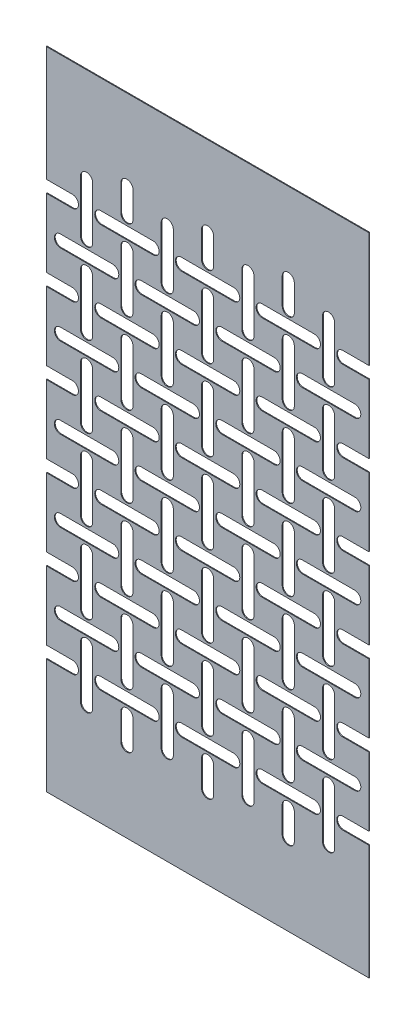
from build123d import *

# Parameters (mm, degrees)
BOSS_EXTRUDE1_DEPTH = 0.2


with BuildPart() as part:
    # Model → Boss-Extrude1 (new body)
    with BuildSketch(Plane.XY):
        with BuildLine():
            Line((0, 31.5), (6.4793, 31.5))
            ThreePointArc((6.4793, 31.5), (7.9793, 30), (6.4793, 28.5))
            Line((6.4793, 28.5), (0, 28.5))
            Line((0, 28.5), (0, 0))
            Line((0, 0), (80, 0))
            Line((80, 0), (80, 28.5))
            Line((80, 28.5), (73.5207, 28.5))
            ThreePointArc((73.5207, 28.5), (72.0207, 30), (73.5207, 31.5))
            Line((73.5207, 31.5), (80, 31.5))
            Line((80, 31.5), (80, 48.5))
            Line((80, 48.5), (73.5207, 48.5))
            ThreePointArc((73.5207, 48.5), (72.0207, 50), (73.5207, 51.5))
            Line((73.5207, 51.5), (80, 51.5))
            Line((80, 51.5), (80, 68.5))
            Line((80, 68.5), (73.5207, 68.5))
            ThreePointArc((73.5207, 68.5), (72.0207, 70), (73.5207, 71.5))
            Line((73.5207, 71.5), (80, 71.5))
            Line((80, 71.5), (80, 88.5))
            Line((80, 88.5), (73.5207, 88.5))
            ThreePointArc((73.5207, 88.5), (72.0207, 90), (73.5207, 91.5))
            Line((73.5207, 91.5), (80, 91.5))
            Line((80, 91.5), (80, 108.5))
            Line((80, 108.5), (73.5207, 108.5))
            ThreePointArc((73.5207, 108.5), (72.0207, 110), (73.5207, 111.5))
            Line((73.5207, 111.5), (80, 111.5))
            Line((80, 111.5), (80, 128.5))
            Line((80, 128.5), (73.5207, 128.5))
            ThreePointArc((73.5207, 128.5), (72.0207, 130), (73.5207, 131.5))
            Line((73.5207, 131.5), (80, 131.5))
            Line((80, 131.5), (80, 160))
            Line((80, 160), (0, 160))
            Line((0, 160), (0, 131.5))
            Line((0, 131.5), (6.4793, 131.5))
            ThreePointArc((6.4793, 131.5), (7.9793, 130), (6.4793, 128.5))
            Line((6.4793, 128.5), (0, 128.5))
            Line((0, 128.5), (0, 111.5))
            Line((0, 111.5), (6.4793, 111.5))
            ThreePointArc((6.4793, 111.5), (7.9793, 110), (6.4793, 108.5))
            Line((6.4793, 108.5), (0, 108.5))
            Line((0, 108.5), (0, 91.5))
            Line((0, 91.5), (6.4793, 91.5))
            ThreePointArc((6.4793, 91.5), (7.9793, 90), (6.4793, 88.5))
            Line((6.4793, 88.5), (0, 88.5))
            Line((0, 88.5), (0, 71.5))
            Line((0, 71.5), (6.4793, 71.5))
            ThreePointArc((6.4793, 71.5), (7.9793, 70), (6.4793, 68.5))
            Line((6.4793, 68.5), (0, 68.5))
            Line((0, 68.5), (0, 51.5))
            Line((0, 51.5), (6.4793, 51.5))
            ThreePointArc((6.4793, 51.5), (7.9793, 50), (6.4793, 48.5))
            Line((6.4793, 48.5), (0, 48.5))
            Line((0, 48.5), (0, 31.5))
        make_face()
        with BuildLine():
            Line((13.5207, 31.5), (26.4793, 31.5))
            ThreePointArc((26.4793, 31.5), (27.9793, 30), (26.4793, 28.5))
            Line((26.4793, 28.5), (13.5207, 28.5))
            ThreePointArc((13.5207, 28.5), (12.0207, 30), (13.5207, 31.5))
        make_face(mode=Mode.SUBTRACT)
        with BuildLine():
            Line((33.5207, 31.5), (46.4793, 31.5))
            ThreePointArc((46.4793, 31.5), (47.9793, 30), (46.4793, 28.5))
            Line((46.4793, 28.5), (33.5207, 28.5))
            ThreePointArc((33.5207, 28.5), (32.0207, 30), (33.5207, 31.5))
        make_face(mode=Mode.SUBTRACT)
        with BuildLine():
            Line((53.5207, 31.5), (66.4793, 31.5))
            ThreePointArc((66.4793, 31.5), (67.9793, 30), (66.4793, 28.5))
            Line((66.4793, 28.5), (53.5207, 28.5))
            ThreePointArc((53.5207, 28.5), (52.0207, 30), (53.5207, 31.5))
        make_face(mode=Mode.SUBTRACT)
        with BuildLine():
            Line((3.5207, 41.5), (16.4793, 41.5))
            ThreePointArc((16.4793, 41.5), (17.9793, 40), (16.4793, 38.5))
            Line((16.4793, 38.5), (3.5207, 38.5))
            ThreePointArc((3.5207, 38.5), (2.0207, 40), (3.5207, 41.5))
        make_face(mode=Mode.SUBTRACT)
        with BuildLine():
            Line((23.5207, 41.5), (36.4793, 41.5))
            ThreePointArc((36.4793, 41.5), (37.9793, 40), (36.4793, 38.5))
            Line((36.4793, 38.5), (23.5207, 38.5))
            ThreePointArc((23.5207, 38.5), (22.0207, 40), (23.5207, 41.5))
        make_face(mode=Mode.SUBTRACT)
        with BuildLine():
            Line((43.5207, 41.5), (56.4793, 41.5))
            ThreePointArc((56.4793, 41.5), (57.9793, 40), (56.4793, 38.5))
            Line((56.4793, 38.5), (43.5207, 38.5))
            ThreePointArc((43.5207, 38.5), (42.0207, 40), (43.5207, 41.5))
        make_face(mode=Mode.SUBTRACT)
        with BuildLine():
            Line((63.5207, 41.5), (76.4793, 41.5))
            ThreePointArc((76.4793, 41.5), (77.9793, 40), (76.4793, 38.5))
            Line((76.4793, 38.5), (63.5207, 38.5))
            ThreePointArc((63.5207, 38.5), (62.0207, 40), (63.5207, 41.5))
        make_face(mode=Mode.SUBTRACT)
        with BuildLine():
            Line((13.5207, 51.5), (26.4793, 51.5))
            ThreePointArc((26.4793, 51.5), (27.9793, 50), (26.4793, 48.5))
            Line((26.4793, 48.5), (13.5207, 48.5))
            ThreePointArc((13.5207, 48.5), (12.0207, 50), (13.5207, 51.5))
        make_face(mode=Mode.SUBTRACT)
        with BuildLine():
            Line((33.5207, 51.5), (46.4793, 51.5))
            ThreePointArc((46.4793, 51.5), (47.9793, 50), (46.4793, 48.5))
            Line((46.4793, 48.5), (33.5207, 48.5))
            ThreePointArc((33.5207, 48.5), (32.0207, 50), (33.5207, 51.5))
        make_face(mode=Mode.SUBTRACT)
        with BuildLine():
            Line((53.5207, 51.5), (66.4793, 51.5))
            ThreePointArc((66.4793, 51.5), (67.9793, 50), (66.4793, 48.5))
            Line((66.4793, 48.5), (53.5207, 48.5))
            ThreePointArc((53.5207, 48.5), (52.0207, 50), (53.5207, 51.5))
        make_face(mode=Mode.SUBTRACT)
        with BuildLine():
            Line((3.5207, 61.5), (16.4793, 61.5))
            ThreePointArc((16.4793, 61.5), (17.9793, 60), (16.4793, 58.5))
            Line((16.4793, 58.5), (3.5207, 58.5))
            ThreePointArc((3.5207, 58.5), (2.0207, 60), (3.5207, 61.5))
        make_face(mode=Mode.SUBTRACT)
        with BuildLine():
            Line((23.5207, 61.5), (36.4793, 61.5))
            ThreePointArc((36.4793, 61.5), (37.9793, 60), (36.4793, 58.5))
            Line((36.4793, 58.5), (23.5207, 58.5))
            ThreePointArc((23.5207, 58.5), (22.0207, 60), (23.5207, 61.5))
        make_face(mode=Mode.SUBTRACT)
        with BuildLine():
            Line((43.5207, 61.5), (56.4793, 61.5))
            ThreePointArc((56.4793, 61.5), (57.9793, 60), (56.4793, 58.5))
            Line((56.4793, 58.5), (43.5207, 58.5))
            ThreePointArc((43.5207, 58.5), (42.0207, 60), (43.5207, 61.5))
        make_face(mode=Mode.SUBTRACT)
        with BuildLine():
            Line((63.5207, 61.5), (76.4793, 61.5))
            ThreePointArc((76.4793, 61.5), (77.9793, 60), (76.4793, 58.5))
            Line((76.4793, 58.5), (63.5207, 58.5))
            ThreePointArc((63.5207, 58.5), (62.0207, 60), (63.5207, 61.5))
        make_face(mode=Mode.SUBTRACT)
        with BuildLine():
            Line((13.5207, 71.5), (26.4793, 71.5))
            ThreePointArc((26.4793, 71.5), (27.9793, 70), (26.4793, 68.5))
            Line((26.4793, 68.5), (13.5207, 68.5))
            ThreePointArc((13.5207, 68.5), (12.0207, 70), (13.5207, 71.5))
        make_face(mode=Mode.SUBTRACT)
        with BuildLine():
            Line((33.5207, 71.5), (46.4793, 71.5))
            ThreePointArc((46.4793, 71.5), (47.9793, 70), (46.4793, 68.5))
            Line((46.4793, 68.5), (33.5207, 68.5))
            ThreePointArc((33.5207, 68.5), (32.0207, 70), (33.5207, 71.5))
        make_face(mode=Mode.SUBTRACT)
        with BuildLine():
            Line((53.5207, 71.5), (66.4793, 71.5))
            ThreePointArc((66.4793, 71.5), (67.9793, 70), (66.4793, 68.5))
            Line((66.4793, 68.5), (53.5207, 68.5))
            ThreePointArc((53.5207, 68.5), (52.0207, 70), (53.5207, 71.5))
        make_face(mode=Mode.SUBTRACT)
        with BuildLine():
            Line((3.5207, 81.5), (16.4793, 81.5))
            ThreePointArc((16.4793, 81.5), (17.9793, 80), (16.4793, 78.5))
            Line((16.4793, 78.5), (3.5207, 78.5))
            ThreePointArc((3.5207, 78.5), (2.0207, 80), (3.5207, 81.5))
        make_face(mode=Mode.SUBTRACT)
        with BuildLine():
            Line((23.5207, 81.5), (36.4793, 81.5))
            ThreePointArc((36.4793, 81.5), (37.9793, 80), (36.4793, 78.5))
            Line((36.4793, 78.5), (23.5207, 78.5))
            ThreePointArc((23.5207, 78.5), (22.0207, 80), (23.5207, 81.5))
        make_face(mode=Mode.SUBTRACT)
        with BuildLine():
            Line((43.5207, 81.5), (56.4793, 81.5))
            ThreePointArc((56.4793, 81.5), (57.9793, 80), (56.4793, 78.5))
            Line((56.4793, 78.5), (43.5207, 78.5))
            ThreePointArc((43.5207, 78.5), (42.0207, 80), (43.5207, 81.5))
        make_face(mode=Mode.SUBTRACT)
        with BuildLine():
            Line((63.5207, 81.5), (76.4793, 81.5))
            ThreePointArc((76.4793, 81.5), (77.9793, 80), (76.4793, 78.5))
            Line((76.4793, 78.5), (63.5207, 78.5))
            ThreePointArc((63.5207, 78.5), (62.0207, 80), (63.5207, 81.5))
        make_face(mode=Mode.SUBTRACT)
        with BuildLine():
            Line((13.5207, 91.5), (26.4793, 91.5))
            ThreePointArc((26.4793, 91.5), (27.9793, 90), (26.4793, 88.5))
            Line((26.4793, 88.5), (13.5207, 88.5))
            ThreePointArc((13.5207, 88.5), (12.0207, 90), (13.5207, 91.5))
        make_face(mode=Mode.SUBTRACT)
        with BuildLine():
            Line((33.5207, 91.5), (46.4793, 91.5))
            ThreePointArc((46.4793, 91.5), (47.9793, 90), (46.4793, 88.5))
            Line((46.4793, 88.5), (33.5207, 88.5))
            ThreePointArc((33.5207, 88.5), (32.0207, 90), (33.5207, 91.5))
        make_face(mode=Mode.SUBTRACT)
        with BuildLine():
            Line((53.5207, 91.5), (66.4793, 91.5))
            ThreePointArc((66.4793, 91.5), (67.9793, 90), (66.4793, 88.5))
            Line((66.4793, 88.5), (53.5207, 88.5))
            ThreePointArc((53.5207, 88.5), (52.0207, 90), (53.5207, 91.5))
        make_face(mode=Mode.SUBTRACT)
        with BuildLine():
            Line((3.5207, 101.5), (16.4793, 101.5))
            ThreePointArc((16.4793, 101.5), (17.9793, 100), (16.4793, 98.5))
            Line((16.4793, 98.5), (3.5207, 98.5))
            ThreePointArc((3.5207, 98.5), (2.0207, 100), (3.5207, 101.5))
        make_face(mode=Mode.SUBTRACT)
        with BuildLine():
            Line((23.5207, 101.5), (36.4793, 101.5))
            ThreePointArc((36.4793, 101.5), (37.9793, 100), (36.4793, 98.5))
            Line((36.4793, 98.5), (23.5207, 98.5))
            ThreePointArc((23.5207, 98.5), (22.0207, 100), (23.5207, 101.5))
        make_face(mode=Mode.SUBTRACT)
        with BuildLine():
            Line((43.5207, 101.5), (56.4793, 101.5))
            ThreePointArc((56.4793, 101.5), (57.9793, 100), (56.4793, 98.5))
            Line((56.4793, 98.5), (43.5207, 98.5))
            ThreePointArc((43.5207, 98.5), (42.0207, 100), (43.5207, 101.5))
        make_face(mode=Mode.SUBTRACT)
        with BuildLine():
            Line((63.5207, 101.5), (76.4793, 101.5))
            ThreePointArc((76.4793, 101.5), (77.9793, 100), (76.4793, 98.5))
            Line((76.4793, 98.5), (63.5207, 98.5))
            ThreePointArc((63.5207, 98.5), (62.0207, 100), (63.5207, 101.5))
        make_face(mode=Mode.SUBTRACT)
        with BuildLine():
            Line((13.5207, 111.5), (26.4793, 111.5))
            ThreePointArc((26.4793, 111.5), (27.9793, 110), (26.4793, 108.5))
            Line((26.4793, 108.5), (13.5207, 108.5))
            ThreePointArc((13.5207, 108.5), (12.0207, 110), (13.5207, 111.5))
        make_face(mode=Mode.SUBTRACT)
        with BuildLine():
            Line((33.5207, 111.5), (46.4793, 111.5))
            ThreePointArc((46.4793, 111.5), (47.9793, 110), (46.4793, 108.5))
            Line((46.4793, 108.5), (33.5207, 108.5))
            ThreePointArc((33.5207, 108.5), (32.0207, 110), (33.5207, 111.5))
        make_face(mode=Mode.SUBTRACT)
        with BuildLine():
            Line((53.5207, 111.5), (66.4793, 111.5))
            ThreePointArc((66.4793, 111.5), (67.9793, 110), (66.4793, 108.5))
            Line((66.4793, 108.5), (53.5207, 108.5))
            ThreePointArc((53.5207, 108.5), (52.0207, 110), (53.5207, 111.5))
        make_face(mode=Mode.SUBTRACT)
        with BuildLine():
            Line((3.5207, 121.5), (16.4793, 121.5))
            ThreePointArc((16.4793, 121.5), (17.9793, 120), (16.4793, 118.5))
            Line((16.4793, 118.5), (3.5207, 118.5))
            ThreePointArc((3.5207, 118.5), (2.0207, 120), (3.5207, 121.5))
        make_face(mode=Mode.SUBTRACT)
        with BuildLine():
            Line((23.5207, 121.5), (36.4793, 121.5))
            ThreePointArc((36.4793, 121.5), (37.9793, 120), (36.4793, 118.5))
            Line((36.4793, 118.5), (23.5207, 118.5))
            ThreePointArc((23.5207, 118.5), (22.0207, 120), (23.5207, 121.5))
        make_face(mode=Mode.SUBTRACT)
        with BuildLine():
            Line((43.5207, 121.5), (56.4793, 121.5))
            ThreePointArc((56.4793, 121.5), (57.9793, 120), (56.4793, 118.5))
            Line((56.4793, 118.5), (43.5207, 118.5))
            ThreePointArc((43.5207, 118.5), (42.0207, 120), (43.5207, 121.5))
        make_face(mode=Mode.SUBTRACT)
        with BuildLine():
            Line((63.5207, 121.5), (76.4793, 121.5))
            ThreePointArc((76.4793, 121.5), (77.9793, 120), (76.4793, 118.5))
            Line((76.4793, 118.5), (63.5207, 118.5))
            ThreePointArc((63.5207, 118.5), (62.0207, 120), (63.5207, 121.5))
        make_face(mode=Mode.SUBTRACT)
        with BuildLine():
            Line((13.5207, 131.5), (26.4793, 131.5))
            ThreePointArc((26.4793, 131.5), (27.9793, 130), (26.4793, 128.5))
            Line((26.4793, 128.5), (13.5207, 128.5))
            ThreePointArc((13.5207, 128.5), (12.0207, 130), (13.5207, 131.5))
        make_face(mode=Mode.SUBTRACT)
        with BuildLine():
            Line((33.5207, 131.5), (46.4793, 131.5))
            ThreePointArc((46.4793, 131.5), (47.9793, 130), (46.4793, 128.5))
            Line((46.4793, 128.5), (33.5207, 128.5))
            ThreePointArc((33.5207, 128.5), (32.0207, 130), (33.5207, 131.5))
        make_face(mode=Mode.SUBTRACT)
        with BuildLine():
            Line((53.5207, 131.5), (66.4793, 131.5))
            ThreePointArc((66.4793, 131.5), (67.9793, 130), (66.4793, 128.5))
            Line((66.4793, 128.5), (53.5207, 128.5))
            ThreePointArc((53.5207, 128.5), (52.0207, 130), (53.5207, 131.5))
        make_face(mode=Mode.SUBTRACT)
        with BuildLine():
            Line((11.5, 23.5207), (11.5, 36.4793))
            ThreePointArc((11.5, 36.4793), (10, 37.9793), (8.5, 36.4793))
            Line((8.5, 36.4793), (8.5, 23.5207))
            ThreePointArc((8.5, 23.5207), (10, 22.0207), (11.5, 23.5207))
        make_face(mode=Mode.SUBTRACT)
        with BuildLine():
            Line((11.5, 43.5207), (11.5, 56.4793))
            ThreePointArc((11.5, 56.4793), (10, 57.9793), (8.5, 56.4793))
            Line((8.5, 56.4793), (8.5, 43.5207))
            ThreePointArc((8.5, 43.5207), (10, 42.0207), (11.5, 43.5207))
        make_face(mode=Mode.SUBTRACT)
        with BuildLine():
            Line((11.5, 63.5207), (11.5, 76.4793))
            ThreePointArc((11.5, 76.4793), (10, 77.9793), (8.5, 76.4793))
            Line((8.5, 76.4793), (8.5, 63.5207))
            ThreePointArc((8.5, 63.5207), (10, 62.0207), (11.5, 63.5207))
        make_face(mode=Mode.SUBTRACT)
        with BuildLine():
            Line((11.5, 83.5207), (11.5, 96.4793))
            ThreePointArc((11.5, 96.4793), (10, 97.9793), (8.5, 96.4793))
            Line((8.5, 96.4793), (8.5, 83.5207))
            ThreePointArc((8.5, 83.5207), (10, 82.0207), (11.5, 83.5207))
        make_face(mode=Mode.SUBTRACT)
        with BuildLine():
            Line((11.5, 103.5207), (11.5, 116.4793))
            ThreePointArc((11.5, 116.4793), (10, 117.9793), (8.5, 116.4793))
            Line((8.5, 116.4793), (8.5, 103.5207))
            ThreePointArc((8.5, 103.5207), (10, 102.0207), (11.5, 103.5207))
        make_face(mode=Mode.SUBTRACT)
        with BuildLine():
            Line((11.5, 123.5207), (11.5, 136.4793))
            ThreePointArc((11.5, 136.4793), (10, 137.9793), (8.5, 136.4793))
            Line((8.5, 136.4793), (8.5, 123.5207))
            ThreePointArc((8.5, 123.5207), (10, 122.0207), (11.5, 123.5207))
        make_face(mode=Mode.SUBTRACT)
        with BuildLine():
            Line((21.5, 20), (21.5, 26.4793))
            ThreePointArc((21.5, 26.4793), (20, 27.9793), (18.5, 26.4793))
            Line((18.5, 26.4793), (18.5, 20))
            ThreePointArc((18.5, 20), (20, 18.5), (21.5, 20))
        make_face(mode=Mode.SUBTRACT)
        with BuildLine():
            Line((21.5, 33.5207), (21.5, 46.4793))
            ThreePointArc((21.5, 46.4793), (20, 47.9793), (18.5, 46.4793))
            Line((18.5, 46.4793), (18.5, 33.5207))
            ThreePointArc((18.5, 33.5207), (20, 32.0207), (21.5, 33.5207))
        make_face(mode=Mode.SUBTRACT)
        with BuildLine():
            Line((21.5, 53.5207), (21.5, 66.4793))
            ThreePointArc((21.5, 66.4793), (20, 67.9793), (18.5, 66.4793))
            Line((18.5, 66.4793), (18.5, 53.5207))
            ThreePointArc((18.5, 53.5207), (20, 52.0207), (21.5, 53.5207))
        make_face(mode=Mode.SUBTRACT)
        with BuildLine():
            Line((21.5, 73.5207), (21.5, 86.4793))
            ThreePointArc((21.5, 86.4793), (20, 87.9793), (18.5, 86.4793))
            Line((18.5, 86.4793), (18.5, 73.5207))
            ThreePointArc((18.5, 73.5207), (20, 72.0207), (21.5, 73.5207))
        make_face(mode=Mode.SUBTRACT)
        with BuildLine():
            Line((21.5, 93.5207), (21.5, 106.4793))
            ThreePointArc((21.5, 106.4793), (20, 107.9793), (18.5, 106.4793))
            Line((18.5, 106.4793), (18.5, 93.5207))
            ThreePointArc((18.5, 93.5207), (20, 92.0207), (21.5, 93.5207))
        make_face(mode=Mode.SUBTRACT)
        with BuildLine():
            Line((21.5, 113.5207), (21.5, 126.4793))
            ThreePointArc((21.5, 126.4793), (20, 127.9793), (18.5, 126.4793))
            Line((18.5, 126.4793), (18.5, 113.5207))
            ThreePointArc((18.5, 113.5207), (20, 112.0207), (21.5, 113.5207))
        make_face(mode=Mode.SUBTRACT)
        with BuildLine():
            Line((21.5, 133.5207), (21.5, 140))
            ThreePointArc((21.5, 140), (20, 141.5), (18.5, 140))
            Line((18.5, 140), (18.5, 133.5207))
            ThreePointArc((18.5, 133.5207), (20, 132.0207), (21.5, 133.5207))
        make_face(mode=Mode.SUBTRACT)
        with BuildLine():
            Line((31.5, 23.5207), (31.5, 36.4793))
            ThreePointArc((31.5, 36.4793), (30, 37.9793), (28.5, 36.4793))
            Line((28.5, 36.4793), (28.5, 23.5207))
            ThreePointArc((28.5, 23.5207), (30, 22.0207), (31.5, 23.5207))
        make_face(mode=Mode.SUBTRACT)
        with BuildLine():
            Line((31.5, 43.5207), (31.5, 56.4793))
            ThreePointArc((31.5, 56.4793), (30, 57.9793), (28.5, 56.4793))
            Line((28.5, 56.4793), (28.5, 43.5207))
            ThreePointArc((28.5, 43.5207), (30, 42.0207), (31.5, 43.5207))
        make_face(mode=Mode.SUBTRACT)
        with BuildLine():
            Line((31.5, 63.5207), (31.5, 76.4793))
            ThreePointArc((31.5, 76.4793), (30, 77.9793), (28.5, 76.4793))
            Line((28.5, 76.4793), (28.5, 63.5207))
            ThreePointArc((28.5, 63.5207), (30, 62.0207), (31.5, 63.5207))
        make_face(mode=Mode.SUBTRACT)
        with BuildLine():
            Line((31.5, 83.5207), (31.5, 96.4793))
            ThreePointArc((31.5, 96.4793), (30, 97.9793), (28.5, 96.4793))
            Line((28.5, 96.4793), (28.5, 83.5207))
            ThreePointArc((28.5, 83.5207), (30, 82.0207), (31.5, 83.5207))
        make_face(mode=Mode.SUBTRACT)
        with BuildLine():
            Line((31.5, 103.5207), (31.5, 116.4793))
            ThreePointArc((31.5, 116.4793), (30, 117.9793), (28.5, 116.4793))
            Line((28.5, 116.4793), (28.5, 103.5207))
            ThreePointArc((28.5, 103.5207), (30, 102.0207), (31.5, 103.5207))
        make_face(mode=Mode.SUBTRACT)
        with BuildLine():
            Line((31.5, 123.5207), (31.5, 136.4793))
            ThreePointArc((31.5, 136.4793), (30, 137.9793), (28.5, 136.4793))
            Line((28.5, 136.4793), (28.5, 123.5207))
            ThreePointArc((28.5, 123.5207), (30, 122.0207), (31.5, 123.5207))
        make_face(mode=Mode.SUBTRACT)
        with BuildLine():
            Line((41.5, 20), (41.5, 26.4793))
            ThreePointArc((41.5, 26.4793), (40, 27.9793), (38.5, 26.4793))
            Line((38.5, 26.4793), (38.5, 20))
            ThreePointArc((38.5, 20), (40, 18.5), (41.5, 20))
        make_face(mode=Mode.SUBTRACT)
        with BuildLine():
            Line((41.5, 33.5207), (41.5, 46.4793))
            ThreePointArc((41.5, 46.4793), (40, 47.9793), (38.5, 46.4793))
            Line((38.5, 46.4793), (38.5, 33.5207))
            ThreePointArc((38.5, 33.5207), (40, 32.0207), (41.5, 33.5207))
        make_face(mode=Mode.SUBTRACT)
        with BuildLine():
            Line((41.5, 53.5207), (41.5, 66.4793))
            ThreePointArc((41.5, 66.4793), (40, 67.9793), (38.5, 66.4793))
            Line((38.5, 66.4793), (38.5, 53.5207))
            ThreePointArc((38.5, 53.5207), (40, 52.0207), (41.5, 53.5207))
        make_face(mode=Mode.SUBTRACT)
        with BuildLine():
            Line((41.5, 73.5207), (41.5, 86.4793))
            ThreePointArc((41.5, 86.4793), (40, 87.9793), (38.5, 86.4793))
            Line((38.5, 86.4793), (38.5, 73.5207))
            ThreePointArc((38.5, 73.5207), (40, 72.0207), (41.5, 73.5207))
        make_face(mode=Mode.SUBTRACT)
        with BuildLine():
            Line((41.5, 93.5207), (41.5, 106.4793))
            ThreePointArc((41.5, 106.4793), (40, 107.9793), (38.5, 106.4793))
            Line((38.5, 106.4793), (38.5, 93.5207))
            ThreePointArc((38.5, 93.5207), (40, 92.0207), (41.5, 93.5207))
        make_face(mode=Mode.SUBTRACT)
        with BuildLine():
            Line((41.5, 113.5207), (41.5, 126.4793))
            ThreePointArc((41.5, 126.4793), (40, 127.9793), (38.5, 126.4793))
            Line((38.5, 126.4793), (38.5, 113.5207))
            ThreePointArc((38.5, 113.5207), (40, 112.0207), (41.5, 113.5207))
        make_face(mode=Mode.SUBTRACT)
        with BuildLine():
            Line((41.5, 133.5207), (41.5, 140))
            ThreePointArc((41.5, 140), (40, 141.5), (38.5, 140))
            Line((38.5, 140), (38.5, 133.5207))
            ThreePointArc((38.5, 133.5207), (40, 132.0207), (41.5, 133.5207))
        make_face(mode=Mode.SUBTRACT)
        with BuildLine():
            Line((51.5, 23.5207), (51.5, 36.4793))
            ThreePointArc((51.5, 36.4793), (50, 37.9793), (48.5, 36.4793))
            Line((48.5, 36.4793), (48.5, 23.5207))
            ThreePointArc((48.5, 23.5207), (50, 22.0207), (51.5, 23.5207))
        make_face(mode=Mode.SUBTRACT)
        with BuildLine():
            Line((51.5, 43.5207), (51.5, 56.4793))
            ThreePointArc((51.5, 56.4793), (50, 57.9793), (48.5, 56.4793))
            Line((48.5, 56.4793), (48.5, 43.5207))
            ThreePointArc((48.5, 43.5207), (50, 42.0207), (51.5, 43.5207))
        make_face(mode=Mode.SUBTRACT)
        with BuildLine():
            Line((51.5, 63.5207), (51.5, 76.4793))
            ThreePointArc((51.5, 76.4793), (50, 77.9793), (48.5, 76.4793))
            Line((48.5, 76.4793), (48.5, 63.5207))
            ThreePointArc((48.5, 63.5207), (50, 62.0207), (51.5, 63.5207))
        make_face(mode=Mode.SUBTRACT)
        with BuildLine():
            Line((51.5, 83.5207), (51.5, 96.4793))
            ThreePointArc((51.5, 96.4793), (50, 97.9793), (48.5, 96.4793))
            Line((48.5, 96.4793), (48.5, 83.5207))
            ThreePointArc((48.5, 83.5207), (50, 82.0207), (51.5, 83.5207))
        make_face(mode=Mode.SUBTRACT)
        with BuildLine():
            Line((51.5, 103.5207), (51.5, 116.4793))
            ThreePointArc((51.5, 116.4793), (50, 117.9793), (48.5, 116.4793))
            Line((48.5, 116.4793), (48.5, 103.5207))
            ThreePointArc((48.5, 103.5207), (50, 102.0207), (51.5, 103.5207))
        make_face(mode=Mode.SUBTRACT)
        with BuildLine():
            Line((51.5, 123.5207), (51.5, 136.4793))
            ThreePointArc((51.5, 136.4793), (50, 137.9793), (48.5, 136.4793))
            Line((48.5, 136.4793), (48.5, 123.5207))
            ThreePointArc((48.5, 123.5207), (50, 122.0207), (51.5, 123.5207))
        make_face(mode=Mode.SUBTRACT)
        with BuildLine():
            Line((61.5, 20), (61.5, 26.4793))
            ThreePointArc((61.5, 26.4793), (60, 27.9793), (58.5, 26.4793))
            Line((58.5, 26.4793), (58.5, 20))
            ThreePointArc((58.5, 20), (60, 18.5), (61.5, 20))
        make_face(mode=Mode.SUBTRACT)
        with BuildLine():
            Line((61.5, 33.5207), (61.5, 46.4793))
            ThreePointArc((61.5, 46.4793), (60, 47.9793), (58.5, 46.4793))
            Line((58.5, 46.4793), (58.5, 33.5207))
            ThreePointArc((58.5, 33.5207), (60, 32.0207), (61.5, 33.5207))
        make_face(mode=Mode.SUBTRACT)
        with BuildLine():
            Line((61.5, 53.5207), (61.5, 66.4793))
            ThreePointArc((61.5, 66.4793), (60, 67.9793), (58.5, 66.4793))
            Line((58.5, 66.4793), (58.5, 53.5207))
            ThreePointArc((58.5, 53.5207), (60, 52.0207), (61.5, 53.5207))
        make_face(mode=Mode.SUBTRACT)
        with BuildLine():
            Line((61.5, 73.5207), (61.5, 86.4793))
            ThreePointArc((61.5, 86.4793), (60, 87.9793), (58.5, 86.4793))
            Line((58.5, 86.4793), (58.5, 73.5207))
            ThreePointArc((58.5, 73.5207), (60, 72.0207), (61.5, 73.5207))
        make_face(mode=Mode.SUBTRACT)
        with BuildLine():
            Line((61.5, 93.5207), (61.5, 106.4793))
            ThreePointArc((61.5, 106.4793), (60, 107.9793), (58.5, 106.4793))
            Line((58.5, 106.4793), (58.5, 93.5207))
            ThreePointArc((58.5, 93.5207), (60, 92.0207), (61.5, 93.5207))
        make_face(mode=Mode.SUBTRACT)
        with BuildLine():
            Line((61.5, 113.5207), (61.5, 126.4793))
            ThreePointArc((61.5, 126.4793), (60, 127.9793), (58.5, 126.4793))
            Line((58.5, 126.4793), (58.5, 113.5207))
            ThreePointArc((58.5, 113.5207), (60, 112.0207), (61.5, 113.5207))
        make_face(mode=Mode.SUBTRACT)
        with BuildLine():
            Line((61.5, 133.5207), (61.5, 140))
            ThreePointArc((61.5, 140), (60, 141.5), (58.5, 140))
            Line((58.5, 140), (58.5, 133.5207))
            ThreePointArc((58.5, 133.5207), (60, 132.0207), (61.5, 133.5207))
        make_face(mode=Mode.SUBTRACT)
        with BuildLine():
            Line((71.5, 23.5207), (71.5, 36.4793))
            ThreePointArc((71.5, 36.4793), (70, 37.9793), (68.5, 36.4793))
            Line((68.5, 36.4793), (68.5, 23.5207))
            ThreePointArc((68.5, 23.5207), (70, 22.0207), (71.5, 23.5207))
        make_face(mode=Mode.SUBTRACT)
        with BuildLine():
            Line((71.5, 43.5207), (71.5, 56.4793))
            ThreePointArc((71.5, 56.4793), (70, 57.9793), (68.5, 56.4793))
            Line((68.5, 56.4793), (68.5, 43.5207))
            ThreePointArc((68.5, 43.5207), (70, 42.0207), (71.5, 43.5207))
        make_face(mode=Mode.SUBTRACT)
        with BuildLine():
            Line((71.5, 63.5207), (71.5, 76.4793))
            ThreePointArc((71.5, 76.4793), (70, 77.9793), (68.5, 76.4793))
            Line((68.5, 76.4793), (68.5, 63.5207))
            ThreePointArc((68.5, 63.5207), (70, 62.0207), (71.5, 63.5207))
        make_face(mode=Mode.SUBTRACT)
        with BuildLine():
            Line((71.5, 83.5207), (71.5, 96.4793))
            ThreePointArc((71.5, 96.4793), (70, 97.9793), (68.5, 96.4793))
            Line((68.5, 96.4793), (68.5, 83.5207))
            ThreePointArc((68.5, 83.5207), (70, 82.0207), (71.5, 83.5207))
        make_face(mode=Mode.SUBTRACT)
        with BuildLine():
            Line((71.5, 103.5207), (71.5, 116.4793))
            ThreePointArc((71.5, 116.4793), (70, 117.9793), (68.5, 116.4793))
            Line((68.5, 116.4793), (68.5, 103.5207))
            ThreePointArc((68.5, 103.5207), (70, 102.0207), (71.5, 103.5207))
        make_face(mode=Mode.SUBTRACT)
        with BuildLine():
            Line((71.5, 123.5207), (71.5, 136.4793))
            ThreePointArc((71.5, 136.4793), (70, 137.9793), (68.5, 136.4793))
            Line((68.5, 136.4793), (68.5, 123.5207))
            ThreePointArc((68.5, 123.5207), (70, 122.0207), (71.5, 123.5207))
        make_face(mode=Mode.SUBTRACT)
    extrude(amount=BOSS_EXTRUDE1_DEPTH)


solid = part.part
